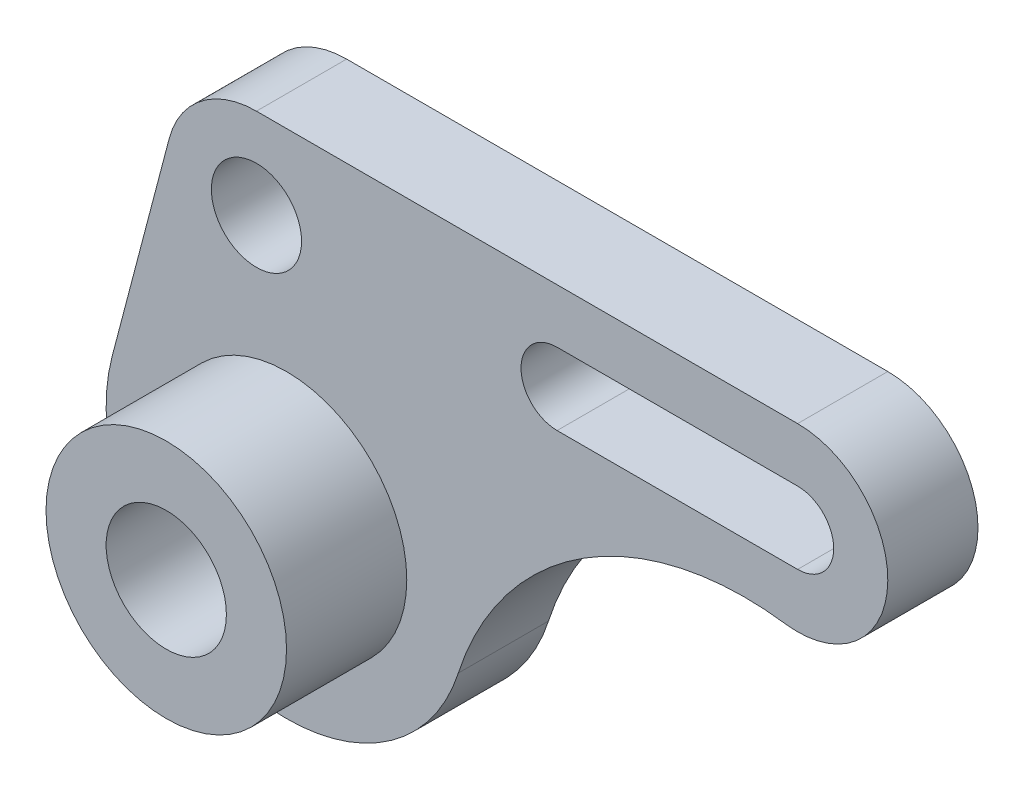
from build123d import *

# Parameters (mm, degrees)
SKETCH1_R           = 10
SKETCH1_R_2         = 7.5
BOSS_EXTRUDE1_DEPTH = 7.5
BOSS_EXTRUDE2_START = 7.5
SKETCH2_R           = 20
SKETCH2_R_2         = 10
BOSS_EXTRUDE2_DEPTH = 20


with BuildPart() as part:
    # Sketch1 → Boss-Extrude1 (new, symmetric)
    with BuildSketch(Plane.XY):
        with BuildLine():
            Line((-5, 55), (85, 55))
            ThreePointArc((85, 55), (99.965341128, 38.980899952), (82.966509351, 25.138475321))
            ThreePointArc((82.966509351, 25.138475321), (49.525739839, 17.897965522), (28.570577696, -9.149977603))
            ThreePointArc((28.570577696, -9.149977603), (-8.389479092, -28.803066513), (-29.015316087, 7.623085489))
            Line((-29.015316087, 7.623085489), (-19.507658043, 43.811542745))
            ThreePointArc((-19.507658043, 43.811542745), (-14.16042736, 51.877986807), (-5, 55))
        make_face()
        Circle(SKETCH1_R, mode=Mode.SUBTRACT)
        with Locations((-5, 40)):
            Circle(SKETCH1_R_2, mode=Mode.SUBTRACT)
        with BuildLine():
            ThreePointArc((45, 46), (39, 40), (45, 34))
            Line((45, 34), (85, 34))
            ThreePointArc((85, 34), (91, 40), (85, 46))
            Line((85, 46), (45, 46))
        make_face(mode=Mode.SUBTRACT)
    extrude(amount=BOSS_EXTRUDE1_DEPTH, both=True)

    # Sketch2 → Boss-Extrude2 (add)
    with BuildSketch(Plane.XY.offset(BOSS_EXTRUDE2_START)):
        Circle(SKETCH2_R)
        Circle(SKETCH2_R_2, mode=Mode.SUBTRACT)
    extrude(amount=BOSS_EXTRUDE2_DEPTH)


solid = part.part
